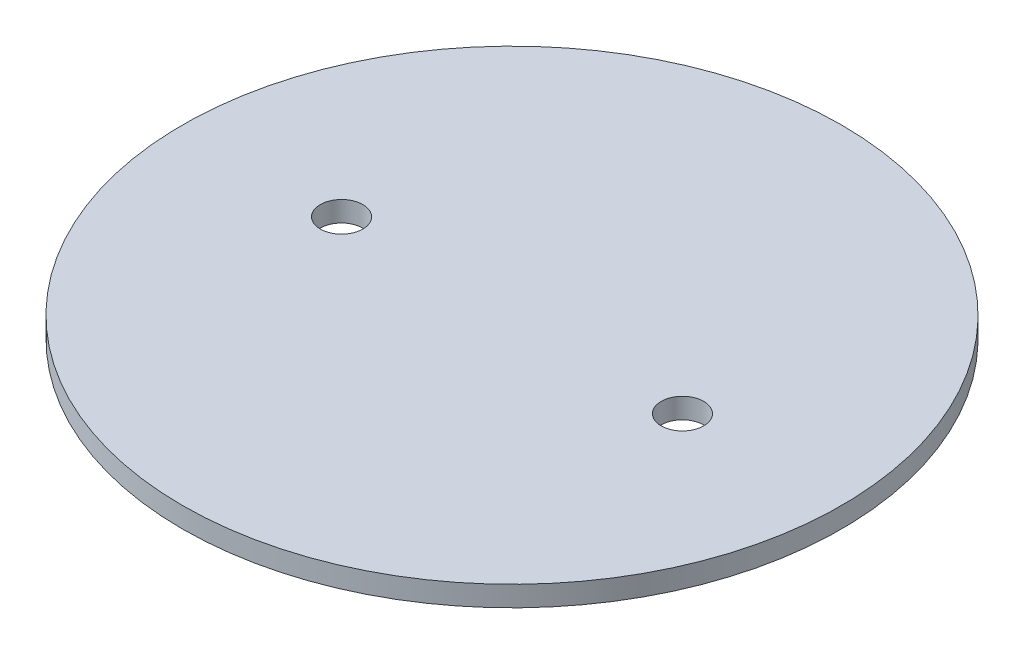
from build123d import *

# Parameters (mm, degrees)
SKETCH1_R           = 96.9
SKETCH1_R_2         = 6.25
BOSS_EXTRUDE1_DEPTH = 3


with BuildPart() as part:
    # Sketch1 → Boss-Extrude1 (new, symmetric)
    with BuildSketch(Plane(origin=(0, 0, 0), x_dir=(1, 0, 0), z_dir=(0, 1, 0))):
        with Locations(Location((0, 0, 0), (0, 0, 270))):
            Circle(SKETCH1_R)
        with Locations(Location((50.115, 0, 0), (0, 0, 270))):
            Circle(SKETCH1_R_2, mode=Mode.SUBTRACT)
        with Locations(Location((-50.115, 0, 0), (0, 0, 90))):
            Circle(SKETCH1_R_2, mode=Mode.SUBTRACT)
    extrude(amount=BOSS_EXTRUDE1_DEPTH, both=True)


solid = part.part
